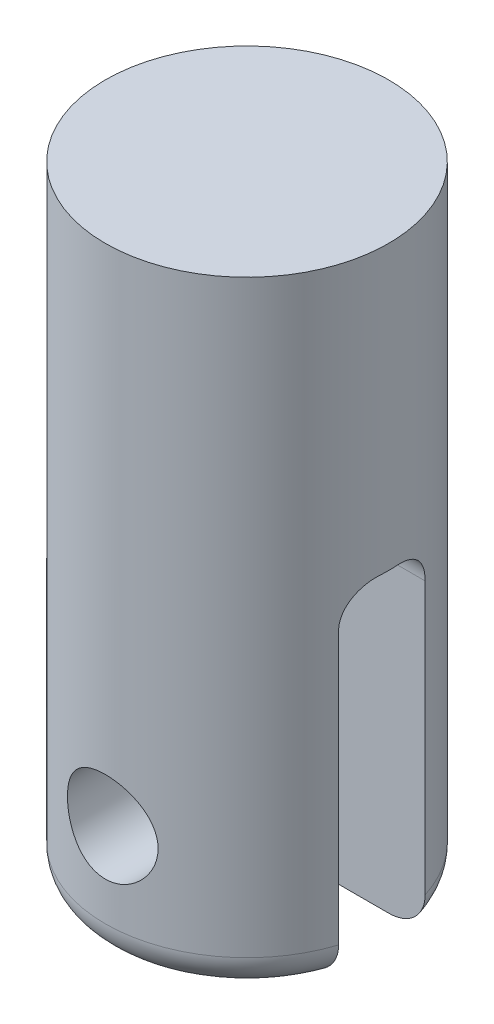
from build123d import *

# Parameters (mm, degrees)
EXTRUDE_START       = -15
SKETCH_1_R          = 12.5
EXTRUDE_1_DEPTH     = 55
SKETCH_2_W          = 7.63538833
SKETCH_2_H          = 30
CUT_EXTRUDE_2_DEPTH = 25
FILLET_1_R          = 3
SKETCH_3_R          = 4
CUT_EXTRUDE_3_DEPTH = 25
FILLET_2_R          = 3


with BuildPart() as part:
    # Эскиз1 → Вытянуть1 (new body)
    with BuildSketch(Plane(origin=(0, 0, 0), x_dir=(1, 0, 0), z_dir=(0, 1, 0)).offset(EXTRUDE_START)):
        with Locations(Location((0, 0, 0), (0, 0, 270))):
            Circle(SKETCH_1_R)
    extrude(amount=EXTRUDE_1_DEPTH)

    # Эскиз2 → Вытянуть2 (cut, symmetric)
    with BuildSketch(Plane(origin=(0, 0, 0), x_dir=(0, 0, -1), z_dir=(1, 0, 0))):
        Rectangle(SKETCH_2_W, SKETCH_2_H)
    extrude(amount=CUT_EXTRUDE_2_DEPTH, both=True, mode=Mode.SUBTRACT)

    # Скругление1
    fillet_1_edges = [part.edges().sort_by_distance(p)[0] for p in [
        (0, -15, -12.5),
        (7.366438181, -15, 10.098791439),
    ]]
    fillet(fillet_1_edges, radius=FILLET_1_R)

    # Эскиз3 → Вытянуть3 (cut, symmetric)
    with BuildSketch(Plane.XY):
        with Locations((0, -4.581717599)):
            Circle(SKETCH_3_R)
    extrude(amount=CUT_EXTRUDE_3_DEPTH, both=True, mode=Mode.SUBTRACT)

    # Скругление2
    fillet_2_edges = [part.edges().sort_by_distance(p)[0] for p in [
        (0, 15, -3.817694165),
        (0, 15, 3.817694165),
    ]]
    fillet(fillet_2_edges, radius=FILLET_2_R)


solid = part.part
